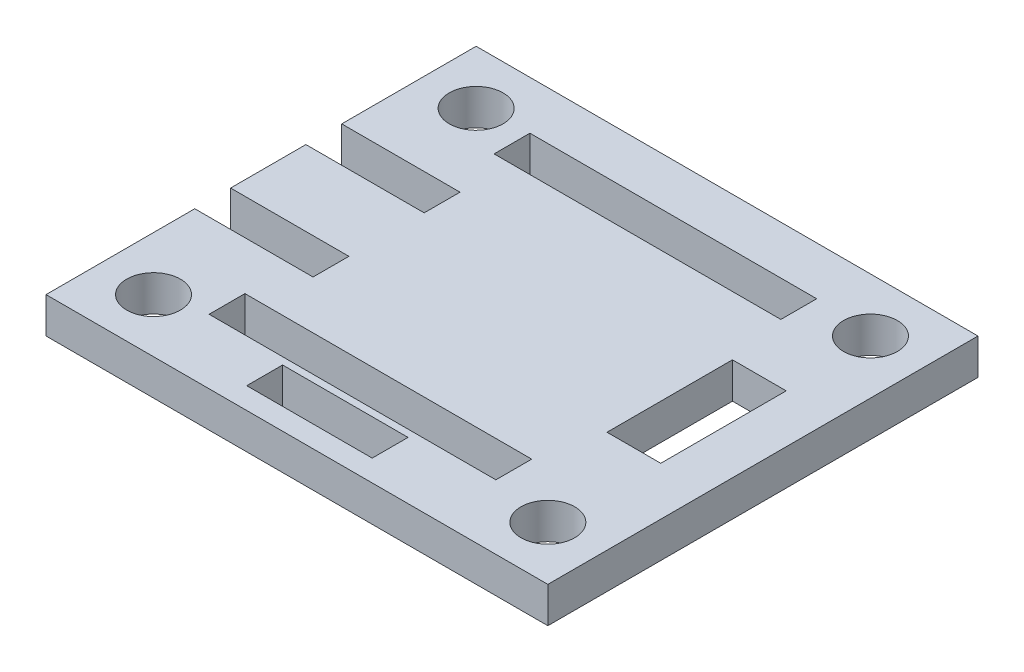
from build123d import *

# Parameters (mm, degrees)
SKETCH_1_W          = 28
SKETCH_1_H          = 24
EXTRUDE_1_DEPTH     = 2
SKETCH_1_5_R        = 1.5
SKETCH_1_5_W        = 7
SKETCH_1_5_H        = 2
SKETCH_1_5_W_2      = 3
SKETCH_1_5_H_2      = 7
SKETCH_1_5_W_3      = 16
SKETCH_1_5_W_4      = 6.6
CUT_EXTRUDE_1_DEPTH = 37.932370625


with BuildPart() as part:
    # 草图1 → 凸台-拉伸1 (new body)
    with BuildSketch(Plane(origin=(0, 0, 0), x_dir=(1, 0, 0), z_dir=(0, 1, 0))):
        with Locations((-14, -12)):
            Rectangle(SKETCH_1_W, SKETCH_1_H)
    extrude(amount=EXTRUDE_1_DEPTH)

    # 草图1<5> → 切除-拉伸1 (cut, through all)
    with BuildSketch(Plane(origin=(0, 0, 0), x_dir=(1, 0, 0), z_dir=(0, 1, 0))):
        with Locations((-25, -3)):
            Circle(SKETCH_1_5_R)
        with Locations((-3, -3)):
            Circle(SKETCH_1_5_R)
        with Locations((-25, -21)):
            Circle(SKETCH_1_5_R)
        with Locations((-3, -21)):
            Circle(SKETCH_1_5_R)
        with Locations((-14.5, -21.8)):
            Rectangle(SKETCH_1_5_W, SKETCH_1_5_H)
        with Locations((-4.2, -11.5)):
            Rectangle(SKETCH_1_5_W_2, SKETCH_1_5_H_2)
        with Locations((-14.3, -3.7)):
            Rectangle(SKETCH_1_5_W_3, SKETCH_1_5_H)
        with Locations((-24.7, -14.7)):
            Rectangle(SKETCH_1_5_W_4, SKETCH_1_5_H)
        with Locations((-24.7, -8.5)):
            Rectangle(SKETCH_1_5_W_4, SKETCH_1_5_H)
        with Locations((-14.5, -19.4)):
            Rectangle(SKETCH_1_5_W_3, SKETCH_1_5_H)
    extrude(amount=CUT_EXTRUDE_1_DEPTH, mode=Mode.SUBTRACT)


solid = part.part
